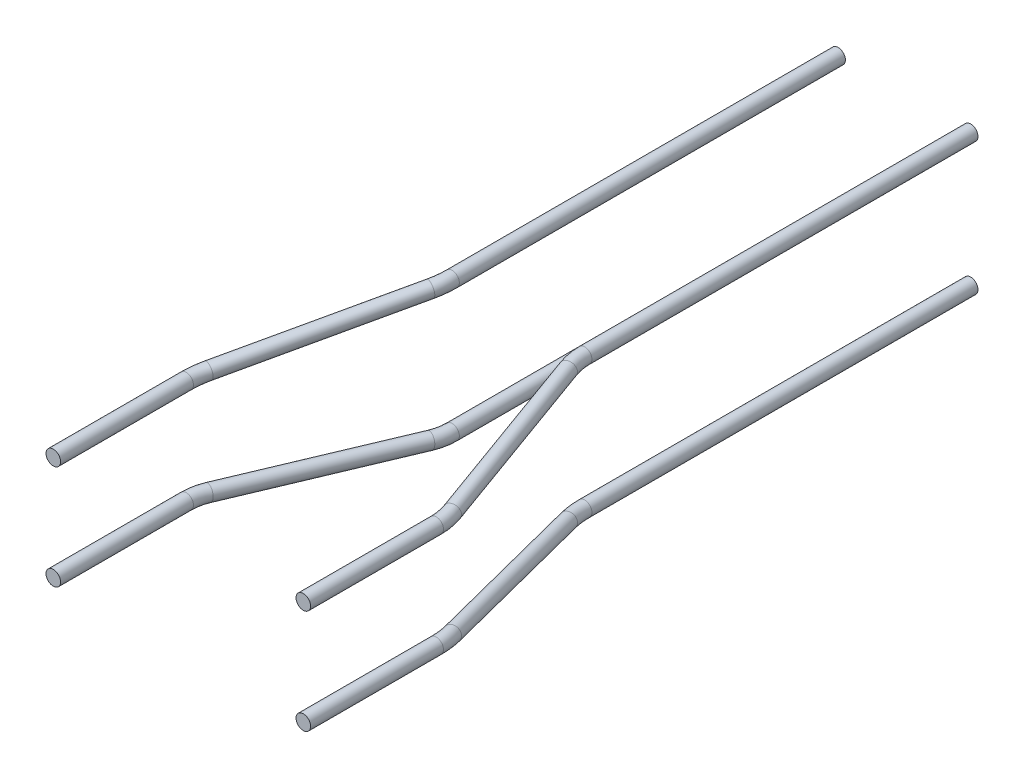
from build123d import *

# Parameters (mm, degrees)
PIPE_1_PROFILE_R = 3.5
PIPE_2_PROFILE_R = 3.5
PIPE_3_PROFILE_R = 3.5
PIPE_4_PROFILE_R = 3.5


with BuildPart() as part:
    # Pipe 1: sweep along a curve in space
    with BuildLine() as pipe_1_path:
        Line((271.819805153, 31.819805153, -40), (271.819805153, 31.819805153, 145.286984437))
        ThreePointArc((271.819805153, 31.819805153, 145.286984437), (272.173100401, 31.734305221, 149.942894929), (273.224424767, 31.479877338, 154.485979103))
        Line((273.224424767, 31.479877338, 154.485979103), (298.595380387, 25.339927816, 235.514020897))
        ThreePointArc((298.595380387, 25.339927816, 235.514020897), (299.646704753, 25.085499932, 240.057105071), (300, 25, 244.713015563))
        Line((300, 25, 244.713015563), (300, 25, 308.5))
    # Pipe 1 profile (on start of the path) → Pipe 1 (sweep)
    with BuildSketch(Plane(origin=(271.819805153, 31.819805153, -40), x_dir=(1, 0, 0), z_dir=(0, 0, 1))):
        Circle(PIPE_1_PROFILE_R)
    sweep(path=pipe_1_path.line)


with BuildPart() as body_2:
    # Pipe 2: sweep along a curve in space
    with BuildLine() as pipe_2_path:
        Line((208.180194847, 31.819805153, -40), (208.180194847, 31.819805153, 145.286984437))
        ThreePointArc((208.180194847, 31.819805153, 145.286984437), (207.826899599, 31.734305221, 149.942894929), (206.775575233, 31.479877338, 154.485979103))
        Line((206.775575233, 31.479877338, 154.485979103), (181.404619613, 25.339927816, 235.514020897))
        ThreePointArc((181.404619613, 25.339927816, 235.514020897), (180.353295247, 25.085499932, 240.057105071), (180, 25, 244.713015563))
        Line((180, 25, 244.713015563), (180, 25, 308.5))
    # Pipe 2 profile (on start of the path) → Pipe 2 (sweep)
    with BuildSketch(Plane(origin=(208.180194847, 31.819805153, -40), x_dir=(1, 0, 0), z_dir=(0, 0, 1))):
        Circle(PIPE_2_PROFILE_R)
    sweep(path=pipe_2_path.line)


with BuildPart() as body_3:
    # Pipe 3: sweep along a curve in space
    with BuildLine() as pipe_3_path:
        Line((208.180194847, -31.819805153, -40), (208.180194847, -31.819805153, 145.286984437))
        ThreePointArc((208.180194847, -31.819805153, 145.286984437), (207.826899599, -31.734305221, 149.942894929), (206.775575233, -31.479877338, 154.485979103))
        Line((206.775575233, -31.479877338, 154.485979103), (181.404619613, -25.339927816, 235.514020897))
        ThreePointArc((181.404619613, -25.339927816, 235.514020897), (180.353295247, -25.085499932, 240.057105071), (180, -25, 244.713015563))
        Line((180, -25, 244.713015563), (180, -25, 308.5))
    # Pipe 3 profile (on start of the path) → Pipe 3 (sweep)
    with BuildSketch(Plane(origin=(208.180194847, -31.819805153, -40), x_dir=(1, 0, 0), z_dir=(0, 0, 1))):
        Circle(PIPE_3_PROFILE_R)
    sweep(path=pipe_3_path.line)


with BuildPart() as body_4:
    # Pipe 4: sweep along a curve in space
    with BuildLine() as pipe_4_path:
        Line((271.819805153, -31.819805153, -40), (271.819805153, -31.819805153, 145.286984437))
        ThreePointArc((271.819805153, -31.819805153, 145.286984437), (272.173100401, -31.734305221, 149.942894929), (273.224424767, -31.479877338, 154.485979103))
        Line((273.224424767, -31.479877338, 154.485979103), (298.595380387, -25.339927816, 235.514020897))
        ThreePointArc((298.595380387, -25.339927816, 235.514020897), (299.646704753, -25.085499932, 240.057105071), (300, -25, 244.713015563))
        Line((300, -25, 244.713015563), (300, -25, 308.5))
    # Pipe 4 profile (on start of the path) → Pipe 4 (sweep)
    with BuildSketch(Plane(origin=(271.819805153, -31.819805153, -40), x_dir=(1, 0, 0), z_dir=(0, 0, 1))):
        Circle(PIPE_4_PROFILE_R)
    sweep(path=pipe_4_path.line)


solid = Compound([part.part, body_2.part, body_3.part, body_4.part])
